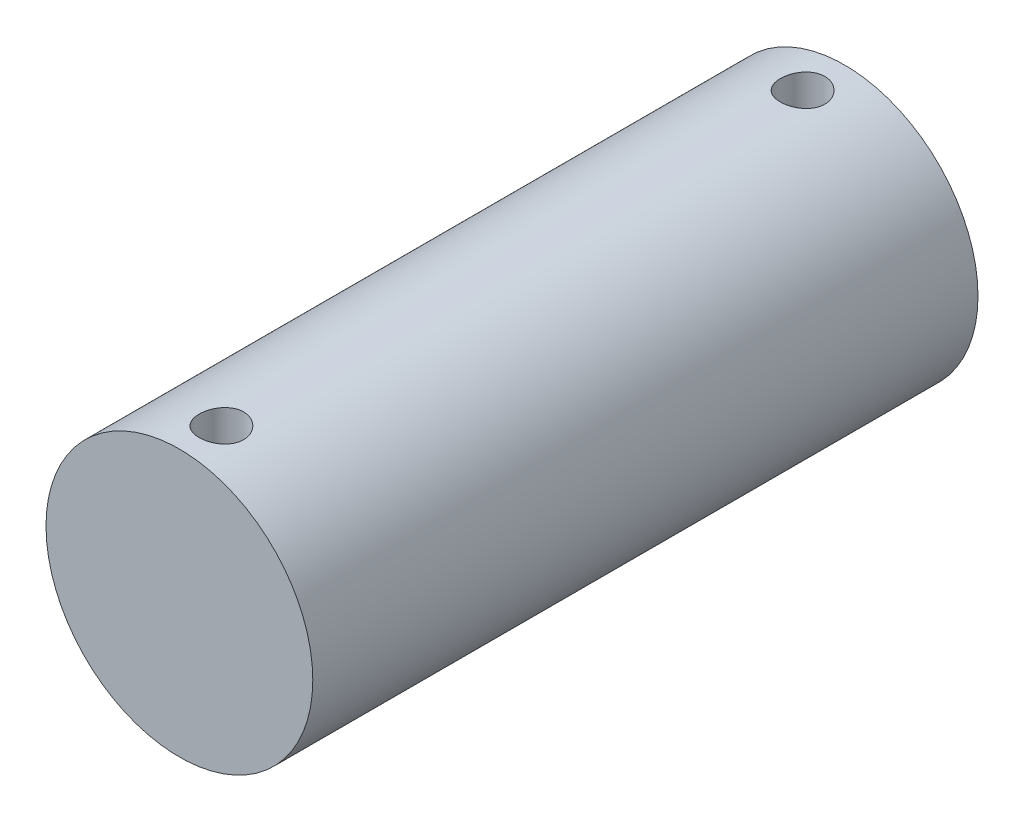
from build123d import *

# Parameters (mm, degrees)
CROQUIS1_R              = 19.05
SALIENTE_EXTRUIR1_DEPTH = 95
CROQUIS2_R              = 3.175
CORTAR_EXTRUIR1_DEPTH   = 35


with BuildPart() as part:
    # Croquis1 → Saliente-Extruir1 (new body)
    with BuildSketch(Plane.XY):
        Circle(CROQUIS1_R)
    extrude(amount=SALIENTE_EXTRUIR1_DEPTH)

    # Croquis2 → Cortar-Extruir1 (cut, symmetric)
    with BuildSketch(Plane(origin=(0, 0, 0), x_dir=(1, 0, 0), z_dir=(0, 1, 0))):
        with Locations(Location((0, -6, 0), (0, 0, 270))):
            Circle(CROQUIS2_R)
        with Locations(Location((0, -89, 0), (0, 0, 270))):
            Circle(CROQUIS2_R)
    extrude(amount=CORTAR_EXTRUIR1_DEPTH, both=True, mode=Mode.SUBTRACT)


solid = part.part
